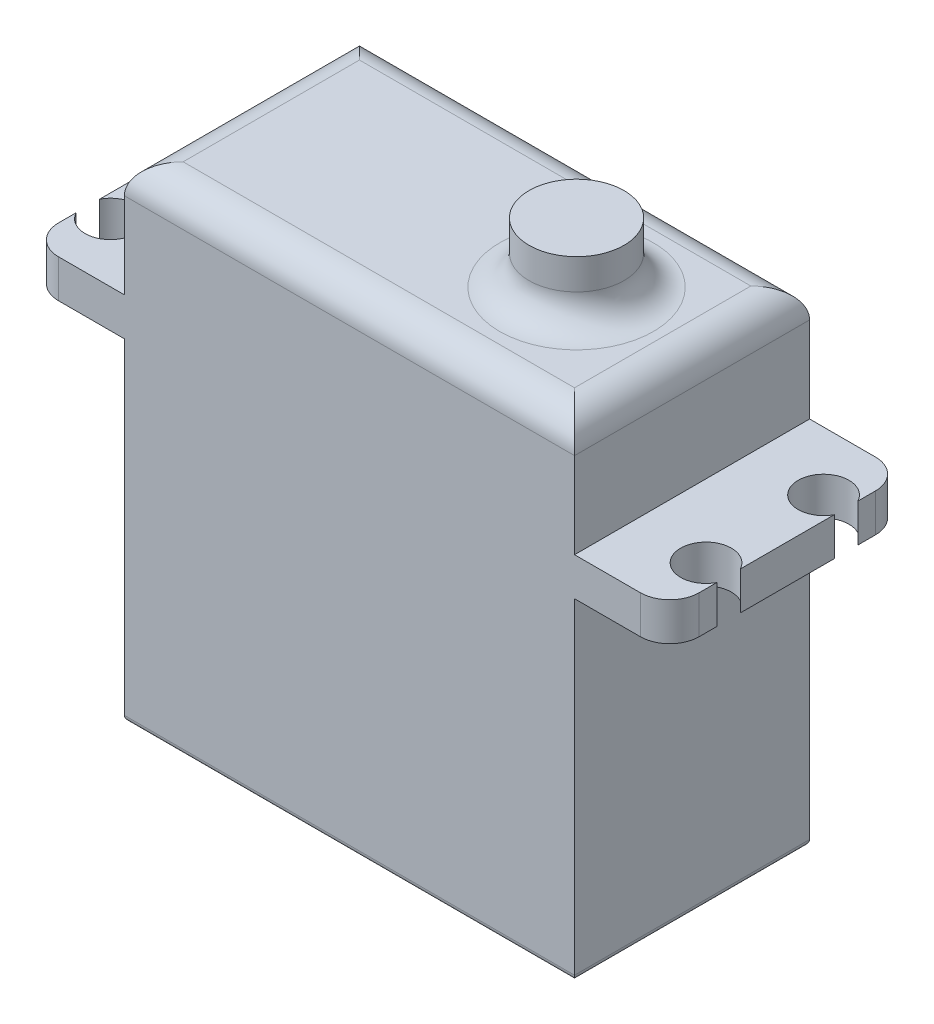
from build123d import *

# Parameters (mm, degrees)
BOSS_EXTRUDE2_DEPTH   = 3.24
BOSS_EXTRUDE2_2_DEPTH = 3.24
SKETCH1_9_W           = 38.3
SKETCH1_9_H           = 20
BOSS_EXTRUDE3_DEPTH   = 13.04
SKETCH2_R             = 4.04
BOSS_EXTRUDE4_DEPTH   = 5.1
SKETCH1_10_W          = 38.3
SKETCH1_10_H          = 20
BOSS_EXTRUDE7_DEPTH   = 16.74
SKETCH5_W             = 38.3
SKETCH5_H             = 20
BOSS_EXTRUDE8_DEPTH   = 11.5
FILLET1_R             = 2.5
FILLET2_R             = 0.5
SKETCH6_R             = 2.03
CUT_EXTRUDE1_DEPTH    = 1.66


with BuildPart() as part:
    # Sketch1 → Boss-Extrude2 (new body)
    with BuildSketch(Plane(origin=(0, 0, 0), x_dir=(1, 0, 0), z_dir=(0, 1, 0))):
        with BuildLine():
            Line((-19.15, -10), (-19.15, 10))
            Line((-19.15, 10), (-24.75, 10))
            ThreePointArc((-24.75, 10), (-26.517766953, 9.267766953), (-27.25, 7.5))
            Line((-27.25, 7.5), (-27.25, 6))
            ThreePointArc((-27.25, 6), (-23.175424329, 5), (-27.25, 4))
            Line((-27.25, 4), (-27.25, -4))
            ThreePointArc((-27.25, -4), (-23.175424329, -5), (-27.25, -6))
            Line((-27.25, -6), (-27.25, -7.5))
            ThreePointArc((-27.25, -7.5), (-26.517766953, -9.267766953), (-24.75, -10))
            Line((-24.75, -10), (-19.15, -10))
        make_face()
    extrude(amount=BOSS_EXTRUDE2_DEPTH)



with BuildPart() as body_2:
    # Sketch1 → Boss-Extrude2 2 (new body)
    with BuildSketch(Plane(origin=(0, 0, 0), x_dir=(1, 0, 0), z_dir=(0, 1, 0))):
        with BuildLine():
            Line((24.75, 10), (19.15, 10))
            Line((19.15, 10), (19.15, -10))
            Line((19.15, -10), (24.75, -10))
            ThreePointArc((24.75, -10), (26.517766953, -9.267766953), (27.25, -7.5))
            Line((27.25, -7.5), (27.25, -6))
            ThreePointArc((27.25, -6), (23.175424329, -5), (27.25, -4))
            Line((27.25, -4), (27.25, 4))
            ThreePointArc((27.25, 4), (23.175424329, 5), (27.25, 6))
            Line((27.25, 6), (27.25, 7.5))
            ThreePointArc((27.25, 7.5), (26.517766953, 9.267766953), (24.75, 10))
        make_face()
    extrude(amount=BOSS_EXTRUDE2_2_DEPTH)


with BuildPart() as part_1:
    add(part.part)

    add(body_2.part)  # Boss-Extrude3 merges body 2
    # Sketch1<9> → Boss-Extrude3 (add)
    with BuildSketch(Plane(origin=(0, 0, 0), x_dir=(1, 0, 0), z_dir=(0, 1, 0))):
        Rectangle(SKETCH1_9_W, SKETCH1_9_H)
    extrude(amount=BOSS_EXTRUDE3_DEPTH)

    # Sketch2 → Boss-Extrude4 (add)
    with BuildSketch(Plane(origin=(0, 13.04, 0), x_dir=(1, 0, 0), z_dir=(0, 1, 0))):
        with Locations(Location((9.32, 0, 0), (0, 0, 270))):
            Circle(SKETCH2_R)
    extrude(amount=BOSS_EXTRUDE4_DEPTH)

    # Sketch1<10> → Boss-Extrude7 (add)
    with BuildSketch(Plane(origin=(0, 0, 0), x_dir=(1, 0, 0), z_dir=(0, 1, 0))):
        Rectangle(SKETCH1_10_W, SKETCH1_10_H)
    extrude(amount=-BOSS_EXTRUDE7_DEPTH)

    # Sketch5 → Boss-Extrude8 (add)
    with BuildSketch(Plane.XZ.offset(16.74)):
        Rectangle(SKETCH5_W, SKETCH5_H)
    extrude(amount=BOSS_EXTRUDE8_DEPTH)

    # Fillet1
    fillet1_edges = [part_1.edges().sort_by_distance(p)[0] for p in [
        (19.15, 13.04, 0),
        (0, 13.04, -10),
        (-19.15, 13.04, 0),
        (0, 13.04, 10),
        (9.32, 13.04, -4.04),
    ]]
    fillet(fillet1_edges, radius=FILLET1_R)

    # Fillet2
    fillet2_edges = [part_1.edges().sort_by_distance(p)[0] for p in [
        (-19.15, -28.24, 0),
        (0, -28.24, -10),
        (19.15, -28.24, 0),
        (0, -28.24, 10),
    ]]
    fillet(fillet2_edges, radius=FILLET2_R)

    # Sketch6 → Cut-Extrude1 (cut)
    with BuildSketch(Plane.XZ.offset(28.24)):
        with Locations((-16.22, 7.07)):
            Circle(SKETCH6_R)
        with BuildLine():
            Line((-18.65, 9.5), (-18.65, 5.04))
            Line((-18.65, 5.04), (-16.22, 5.04))
            ThreePointArc((-16.22, 5.04), (-17.655426766, 8.505426766), (-14.19, 7.07))
            Line((-14.19, 7.07), (-14.19, 9.5))
            Line((-14.19, 9.5), (-18.65, 9.5))
        make_face()
        with Locations((-16.22, -7.07)):
            Circle(SKETCH6_R)
        with BuildLine():
            Line((-16.22, -5.04), (-18.65, -5.04))
            Line((-18.65, -5.04), (-18.65, -9.5))
            Line((-18.65, -9.5), (-14.19, -9.5))
            Line((-14.19, -9.5), (-14.19, -7.07))
            ThreePointArc((-14.19, -7.07), (-17.655426766, -8.505426766), (-16.22, -5.04))
        make_face()
        with Locations((16.22, 6.97)):
            Circle(SKETCH6_R)
        with BuildLine():
            Line((18.65, 9.5), (14.19, 9.5))
            Line((14.19, 9.5), (14.19, 6.97))
            ThreePointArc((14.19, 6.97), (16.22, 9), (18.25, 6.97))
            ThreePointArc((18.25, 6.97), (17.655426766, 5.534573234), (16.22, 4.94))
            Line((16.22, 4.94), (18.65, 4.94))
            Line((18.65, 4.94), (18.65, 9.5))
        make_face()
        with Locations((16.22, -7.07)):
            Circle(SKETCH6_R)
        with BuildLine():
            Line((14.19, -7.07), (14.19, -9.5))
            Line((14.19, -9.5), (18.65, -9.5))
            Line((18.65, -9.5), (18.65, -5.04))
            Line((18.65, -5.04), (16.22, -5.04))
            ThreePointArc((16.22, -5.04), (17.655426766, -5.634573234), (18.25, -7.07))
            ThreePointArc((18.25, -7.07), (16.22, -9.1), (14.19, -7.07))
        make_face()
    extrude(amount=-CUT_EXTRUDE1_DEPTH, mode=Mode.SUBTRACT)


solid = part_1.part
